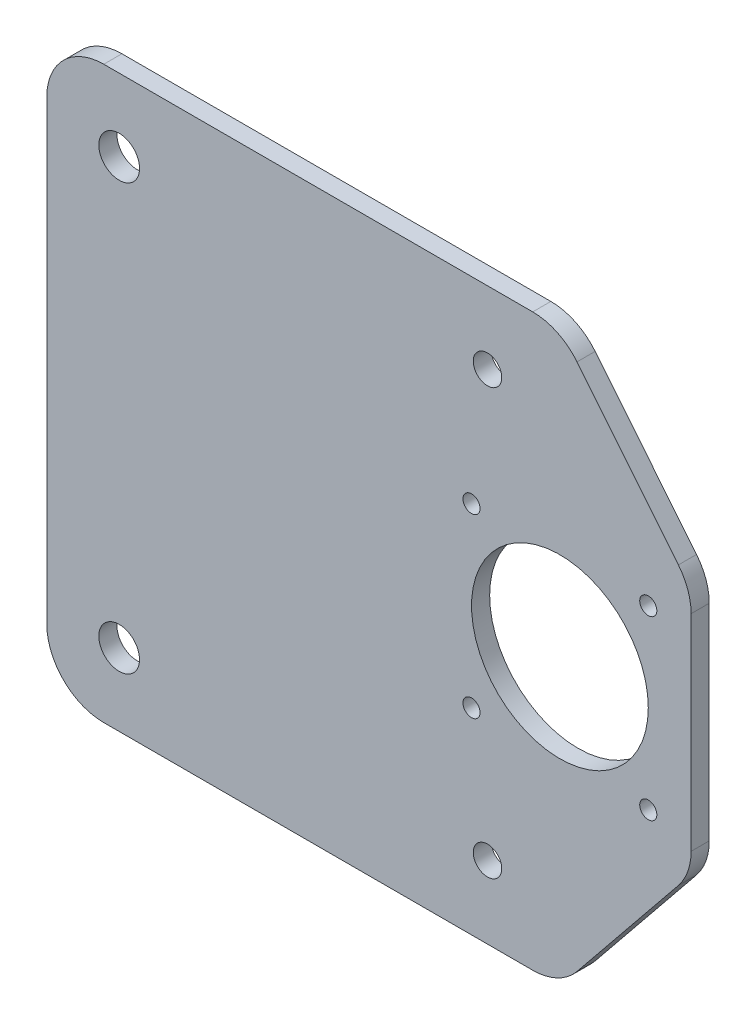
from build123d import *

# Parameters (mm, degrees)
BOSS_EXTRUDE1_START = 15.549813
SKETCH1_W           = 90
SKETCH1_H           = 100
SKETCH1_R           = 2.5
SKETCH1_R_2         = 3.57
BOSS_EXTRUDE1_DEPTH = 3.18
BOSS_EXTRUDE2_DEPTH = 3.18
SKETCH3_R           = 1.5
SKETCH3_R_2         = 15.5
CUT_EXTRUDE1_DEPTH  = 10
FILLET1_R           = 10


with BuildPart() as part:
    # Sketch1 → Boss-Extrude1 (new body)
    with BuildSketch(Plane.XY.offset(BOSS_EXTRUDE1_START)):
        with Locations((0, -5)):
            Rectangle(SKETCH1_W, SKETCH1_H)
        with Locations((32.3, -42.3)):
            Circle(SKETCH1_R, mode=Mode.SUBTRACT)
        with Locations((-32.3, -42.3)):
            Circle(SKETCH1_R_2, mode=Mode.SUBTRACT)
        with Locations((-32.3, 32.3)):
            Circle(SKETCH1_R_2, mode=Mode.SUBTRACT)
        with Locations((32.3, 32.3)):
            Circle(SKETCH1_R, mode=Mode.SUBTRACT)
    extrude(amount=BOSS_EXTRUDE1_DEPTH)

    # Sketch2 → Boss-Extrude2 (add, through all)
    with BuildSketch(Plane.XY.offset(18.729812892)):
        Polygon((45, 45), (68.012220348, 16.59), (68.012220348, -26.59), (45, -55), align=None)
    extrude(amount=-BOSS_EXTRUDE2_DEPTH)

    # Sketch3 → Cut-Extrude1 (cut)
    with BuildSketch(Plane.XY.offset(18.729812892)):
        with Locations((29.5, 10.5)):
            Circle(SKETCH3_R)
        with Locations((60.5, 10.5)):
            Circle(SKETCH3_R)
        with Locations((60.5, -20.5)):
            Circle(SKETCH3_R)
        with Locations((29.5, -20.5)):
            Circle(SKETCH3_R)
        with Locations((45, -5)):
            Circle(SKETCH3_R_2)
    extrude(amount=-CUT_EXTRUDE1_DEPTH, mode=Mode.SUBTRACT)

    # Fillet1
    fillet1_edges = [part.edges().sort_by_distance(p)[0] for p in [
        (68.012220348, 16.59, 17.139812892),
        (68.012220348, -26.59, 17.139812892),
        (-45, 45, 17.139813),
        (45, 45, 17.139813),
        (45, -55, 17.139813),
        (-45, -55, 17.139813),
    ]]
    fillet(fillet1_edges, radius=FILLET1_R)


solid = part.part
